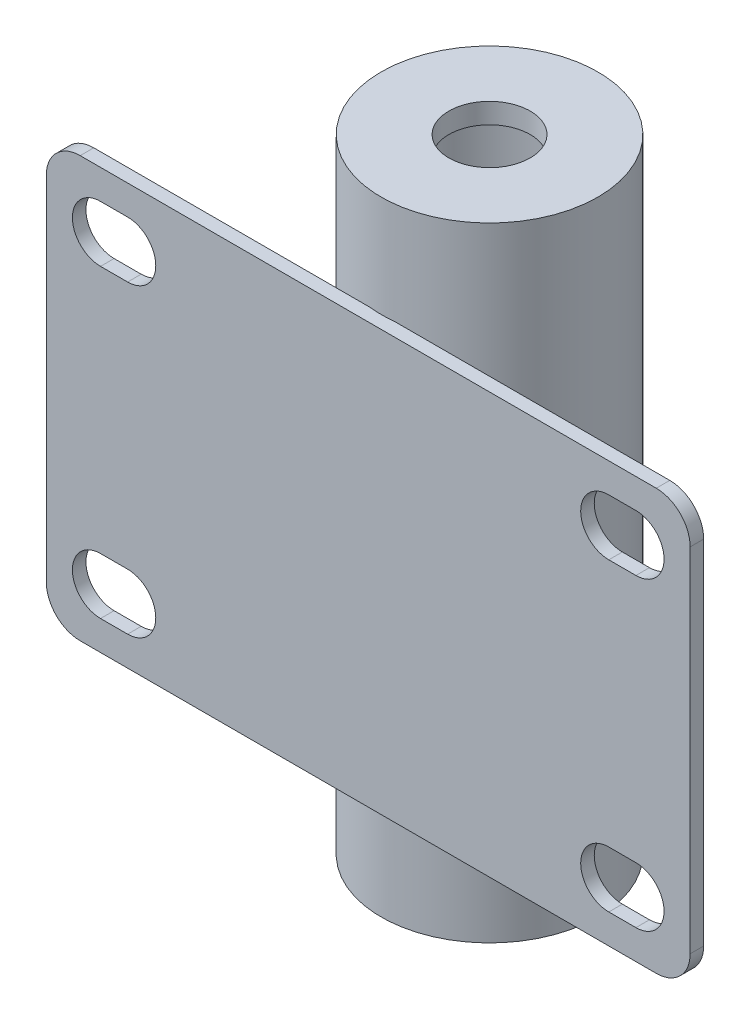
from build123d import *

# Parameters (mm, degrees)
SKETCH_1_W           = 95
SKETCH_1_H           = 62
EXTRUDE_1_DEPTH      = 2
EXTRUDE_2_DEPTH      = 15
EXTRUDE_2_DEPTH_BACK = 77
SKETCH_2_R           = 16
FILLET_1_R           = 5
CUT_EXTRUDE_START    = -3
SKETCH_3_R           = 13
CUT_EXTRUDE_3_DEPTH  = 106.341404828
SKETCH_5_R           = 6
CUT_EXTRUDE_4_DEPTH  = 106.805765438


with BuildPart() as part:
    # 草图1 → 凸台-拉伸1 (new body)
    with BuildSketch(Plane.XY):
        Rectangle(SKETCH_1_W, SKETCH_1_H)
        with BuildLine():
            Line((-39.5, 26.65), (-35.5, 26.65))
            ThreePointArc((-35.5, 26.65), (-31.35, 22.5), (-35.5, 18.35))
            Line((-35.5, 18.35), (-39.5, 18.35))
            ThreePointArc((-39.5, 18.35), (-43.65, 22.5), (-39.5, 26.65))
        make_face(mode=Mode.SUBTRACT)
        with BuildLine():
            Line((39.5, 26.65), (35.5, 26.65))
            ThreePointArc((35.5, 26.65), (31.35, 22.5), (35.5, 18.35))
            Line((35.5, 18.35), (39.5, 18.35))
            ThreePointArc((39.5, 18.35), (43.65, 22.5), (39.5, 26.65))
        make_face(mode=Mode.SUBTRACT)
        with BuildLine():
            Line((-39.5, -26.65), (-35.5, -26.65))
            ThreePointArc((-35.5, -26.65), (-31.35, -22.5), (-35.5, -18.35))
            Line((-35.5, -18.35), (-39.5, -18.35))
            ThreePointArc((-39.5, -18.35), (-43.65, -22.5), (-39.5, -26.65))
        make_face(mode=Mode.SUBTRACT)
        with BuildLine():
            Line((39.5, -26.65), (35.5, -26.65))
            ThreePointArc((35.5, -26.65), (31.35, -22.5), (35.5, -18.35))
            Line((35.5, -18.35), (39.5, -18.35))
            ThreePointArc((39.5, -18.35), (43.65, -22.5), (39.5, -26.65))
        make_face(mode=Mode.SUBTRACT)
    extrude(amount=EXTRUDE_1_DEPTH)

    # 草图2 → 凸台-拉伸2 (add, two sides: drawn at the far end of the back side and taken through both)
    with BuildSketch(Plane(origin=(0, 31, 0), x_dir=(1, 0, 0), z_dir=(0, 1, 0)).offset(-EXTRUDE_2_DEPTH_BACK)):
        with Locations(Location((0, 15.9, 0), (0, 0, 180))):
            Circle(SKETCH_2_R)
    extrude(amount=EXTRUDE_2_DEPTH + EXTRUDE_2_DEPTH_BACK)

    # 圆角1
    fillet_1_edges = [part.edges().sort_by_distance(p)[0] for p in [
        (-47.5, 31, 1),
        (47.5, 31, 1),
        (47.5, -31, 1),
        (-47.5, -31, 1),
    ]]
    fillet(fillet_1_edges, radius=FILLET_1_R)

    # 草图3 → 切除-拉伸3 (cut, through all)
    with BuildSketch(Plane(origin=(0, 46, 0), x_dir=(1, 0, 0), z_dir=(0, 1, 0)).offset(CUT_EXTRUDE_START)):
        with Locations(Location((0, 15.9, 0), (0, 0, 180))):
            Circle(SKETCH_3_R)
    extrude(amount=-CUT_EXTRUDE_3_DEPTH, mode=Mode.SUBTRACT)

    # 草图5 → 切除-拉伸4 (cut, through all)
    with BuildSketch(Plane(origin=(0, 43, 0), x_dir=(-1, 0, 0), z_dir=(0, -1, 0))):
        with Locations(Location((0, 15.9, 0), (0, 0, 180))):
            Circle(SKETCH_5_R)
    extrude(amount=-CUT_EXTRUDE_4_DEPTH, mode=Mode.SUBTRACT)


solid = part.part
